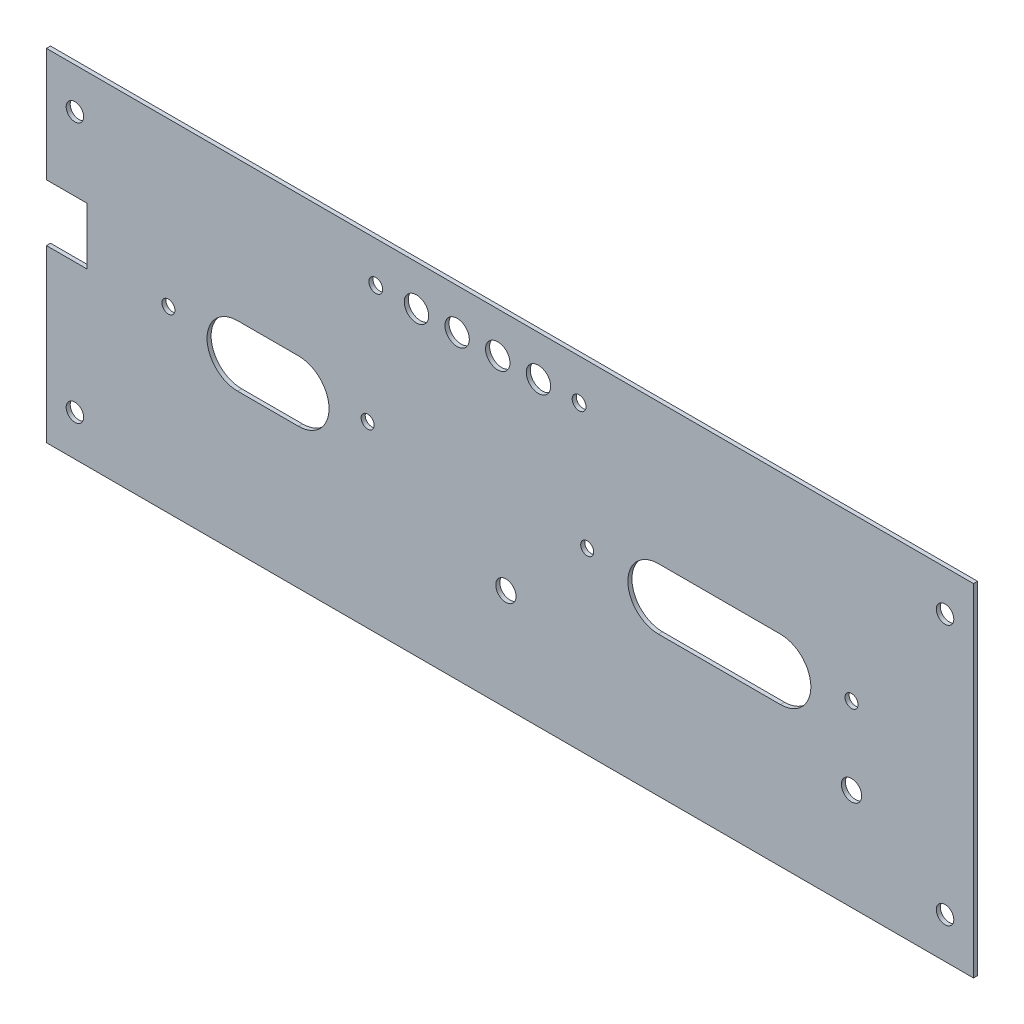
from build123d import *

# Parameters (mm, degrees)
SKETCH_1_W          = 228
SKETCH_1_H          = 84
SKETCH_1_R          = 2.15
EXTRUDE_1_DEPTH     = 1
SKETCH_4_R          = 1.6
SKETCH_4_W          = 14.464145402
SKETCH_4_H          = 14
CUT_EXTRUDE_2_DEPTH = 1
SKETCH_5_R          = 1.7
SKETCH_5_R_2        = 3
SKETCH_5_R_3        = 2.5
CUT_EXTRUDE_3_DEPTH = 10


with BuildPart() as part:
    # Эскиз1 → Вытянуть1 (new body)
    with BuildSketch(Plane.XY):
        Rectangle(SKETCH_1_W, SKETCH_1_H)
        with Locations((107, 32)):
            Circle(SKETCH_1_R, mode=Mode.SUBTRACT)
        with Locations(Location((-107, 32, 0), (0, 0, 180))):
            Circle(SKETCH_1_R, mode=Mode.SUBTRACT)
        with Locations((-107, -32)):
            Circle(SKETCH_1_R, mode=Mode.SUBTRACT)
        with Locations(Location((107, -32, 0), (0, 0, 180))):
            Circle(SKETCH_1_R, mode=Mode.SUBTRACT)
    extrude(amount=EXTRUDE_1_DEPTH)

    # Эскиз4 → Вырез-Вытянуть2 (cut)
    with BuildSketch(Plane.XY.offset(1)):
        with Locations((19, 2)):
            Circle(SKETCH_4_R)
        with Locations((84, 2)):
            Circle(SKETCH_4_R)
        with Locations((-84, 2)):
            Circle(SKETCH_4_R)
        with Locations((-35, 2)):
            Circle(SKETCH_4_R)
        with BuildLine():
            Line((36.5, 7.5), (66.5, 7.5))
            ThreePointArc((66.5, 7.5), (74, 0), (66.5, -7.5))
            Line((66.5, -7.5), (36.5, -7.5))
            ThreePointArc((36.5, -7.5), (29, 0), (36.5, 7.5))
        make_face()
        with BuildLine():
            Line((-67, 7.5), (-52, 7.5))
            ThreePointArc((-52, 7.5), (-44.5, 0), (-52, -7.5))
            Line((-52, -7.5), (-67, -7.5))
            ThreePointArc((-67, -7.5), (-74.5, 0), (-67, 7.5))
        make_face()
        with Locations((-111.232072701, 7)):
            Rectangle(SKETCH_4_W, SKETCH_4_H)
    extrude(amount=-CUT_EXTRUDE_2_DEPTH, mode=Mode.SUBTRACT)

    # Эскиз5 → Вырез-Вытянуть3 (cut)
    with BuildSketch(Plane.XY.offset(1)):
        with Locations((-33, 32)):
            Circle(SKETCH_5_R)
        with Locations((17, 32)):
            Circle(SKETCH_5_R)
        with Locations((7, 32)):
            Circle(SKETCH_5_R_2)
        with Locations((-3, 32)):
            Circle(SKETCH_5_R_2)
        with Locations((-13, 32)):
            Circle(SKETCH_5_R_2)
        with Locations((-23, 32)):
            Circle(SKETCH_5_R_2)
        with Locations((-1, -17)):
            Circle(SKETCH_5_R_3)
        with Locations((84, -17)):
            Circle(SKETCH_5_R_3)
    extrude(amount=-CUT_EXTRUDE_3_DEPTH, mode=Mode.SUBTRACT)


solid = part.part
